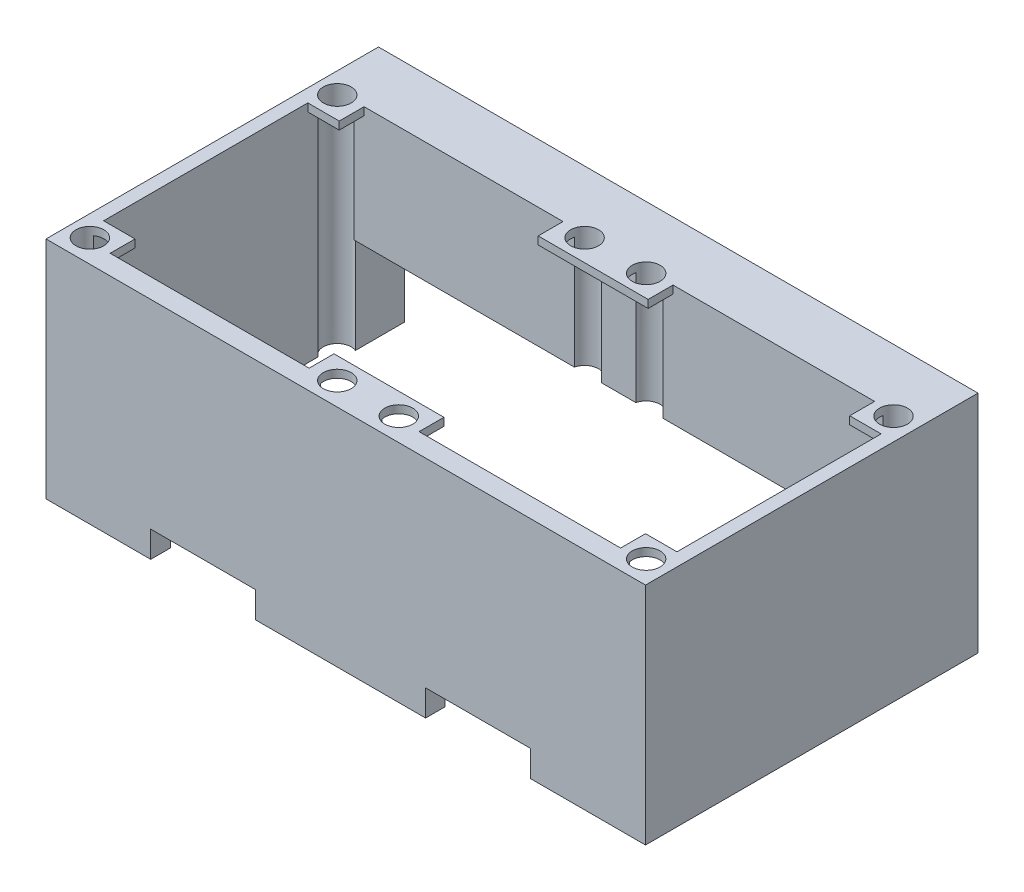
from build123d import *

# Parameters (mm, degrees)
SKETCH1_W             = 58.166
SKETCH1_H             = 28.448
BOSS_EXTRUDE1_DEPTH   = 21.844
SKETCH2_W             = 55.626
SKETCH2_H             = 24.638
CUT_EXTRUDE1_DEPTH    = 40.055132838
SKETCH3_W             = 3.048
SKETCH3_H             = 2.413
SKETCH3_W_2           = 10.668
BOSS_EXTRUDE2_DEPTH   = 0.762
F_2_CLEARANCE_HOLE1_D = 2.7051
CUT_EXTRUDE2_REACH    = 48.177
SKETCH6_W             = 10.16
SKETCH6_H             = 2.54
SKETCH7_W             = 58.166
SKETCH7_H             = 21.844
BOSS_EXTRUDE3_DEPTH   = 3.81
CUT_EXTRUDE3_REACH    = 50.616
SKETCH8_W             = 53.086
SKETCH8_H             = 10.16


with BuildPart() as part:
    # Sketch1 → Boss-Extrude1 (new body)
    with BuildSketch(Plane(origin=(0, 0, 0), x_dir=(1, 0, 0), z_dir=(0, 1, 0))):
        Rectangle(SKETCH1_W, SKETCH1_H)
    extrude(amount=BOSS_EXTRUDE1_DEPTH)

    # Sketch2 → Cut-Extrude1 (cut, through all)
    with BuildSketch(Plane(origin=(0, 21.844, 0), x_dir=(1, 0, 0), z_dir=(0, 1, 0))):
        Rectangle(SKETCH2_W, SKETCH2_H)
    extrude(amount=-CUT_EXTRUDE1_DEPTH, mode=Mode.SUBTRACT)

    # Sketch3 → Boss-Extrude2 (add)
    with BuildSketch(Plane(origin=(0, 21.844, 0), x_dir=(1, 0, 0), z_dir=(0, 1, 0))):
        with Locations((-26.289, 11.1125)):
            Rectangle(SKETCH3_W, SKETCH3_H)
        with Locations((-26.289, -11.1125)):
            Rectangle(SKETCH3_W, SKETCH3_H)
        with Locations((26.289, 11.1125)):
            Rectangle(SKETCH3_W, SKETCH3_H)
        with Locations((26.289, -11.1125)):
            Rectangle(SKETCH3_W, SKETCH3_H)
        with Locations((-0.127, 11.1125)):
            Rectangle(SKETCH3_W_2, SKETCH3_H)
        with Locations((-0.127, -11.1125)):
            Rectangle(SKETCH3_W_2, SKETCH3_H)
    extrude(amount=-BOSS_EXTRUDE2_DEPTH)

    # #2 Clearance Hole1 (through all)
    with Locations(Plane(origin=(0, 21.844, 0), x_dir=(1, 0, 0), z_dir=(0, 1, 0))):
        with Locations((-27.051, 12.0015), (-3.05054, 12.0015), (-3.05054, -11.99896), (-27.051, -11.99896), (2.91846, -11.99896), (26.91892, -11.99896), (26.91892, 12.0015), (2.91846, 12.0015)):
            Hole(F_2_CLEARANCE_HOLE1_D / 2)

    # Sketch6 → Cut-Extrude2 (cut, up to next)
    with BuildSketch(Plane.XY.offset(14.224), mode=Mode.PRIVATE) as cut_extrude2_sk1:
        with Locations((-13.843, 1.27)):
            Rectangle(SKETCH6_W, SKETCH6_H)
    cut_extrude2_tool1 = extrude(cut_extrude2_sk1.sketch, amount=-CUT_EXTRUDE2_REACH, mode=Mode.PRIVATE) & part.part
    # Sketch6 → Cut-Extrude2 (cut, up to next)
    with BuildSketch(Plane.XY.offset(14.224), mode=Mode.PRIVATE) as cut_extrude2_sk2:
        with Locations((12.827, 1.27)):
            Rectangle(SKETCH6_W, SKETCH6_H)
    cut_extrude2_tool2 = extrude(cut_extrude2_sk2.sketch, amount=-CUT_EXTRUDE2_REACH, mode=Mode.PRIVATE) & part.part
    add(cut_extrude2_tool1.solids().sort_by_distance((-13.843, 1.27, 14.224))[0], mode=Mode.SUBTRACT)
    add(cut_extrude2_tool2.solids().sort_by_distance((12.827, 1.27, 14.224))[0], mode=Mode.SUBTRACT)

    # Sketch7 → Boss-Extrude3 (add)
    with BuildSketch(Plane(origin=(0, 0, -14.224), x_dir=(-1, 0, 0), z_dir=(0, 0, -1))):
        with Locations((0, 10.922)):
            Rectangle(SKETCH7_W, SKETCH7_H)
    extrude(amount=BOSS_EXTRUDE3_DEPTH)

    # Sketch8 → Cut-Extrude3 (cut, up to next)
    with BuildSketch(Plane(origin=(0, 0, -18.034), x_dir=(-1, 0, 0), z_dir=(0, 0, -1)), mode=Mode.PRIVATE) as cut_extrude3_sk1:
        with Locations((0, 5.08)):
            Rectangle(SKETCH8_W, SKETCH8_H)
    cut_extrude3_tool1 = extrude(cut_extrude3_sk1.sketch, amount=-CUT_EXTRUDE3_REACH, mode=Mode.PRIVATE) & part.part
    add(cut_extrude3_tool1.solids().sort_by_distance((0, 5.08, -18.034))[0], mode=Mode.SUBTRACT)


solid = part.part
